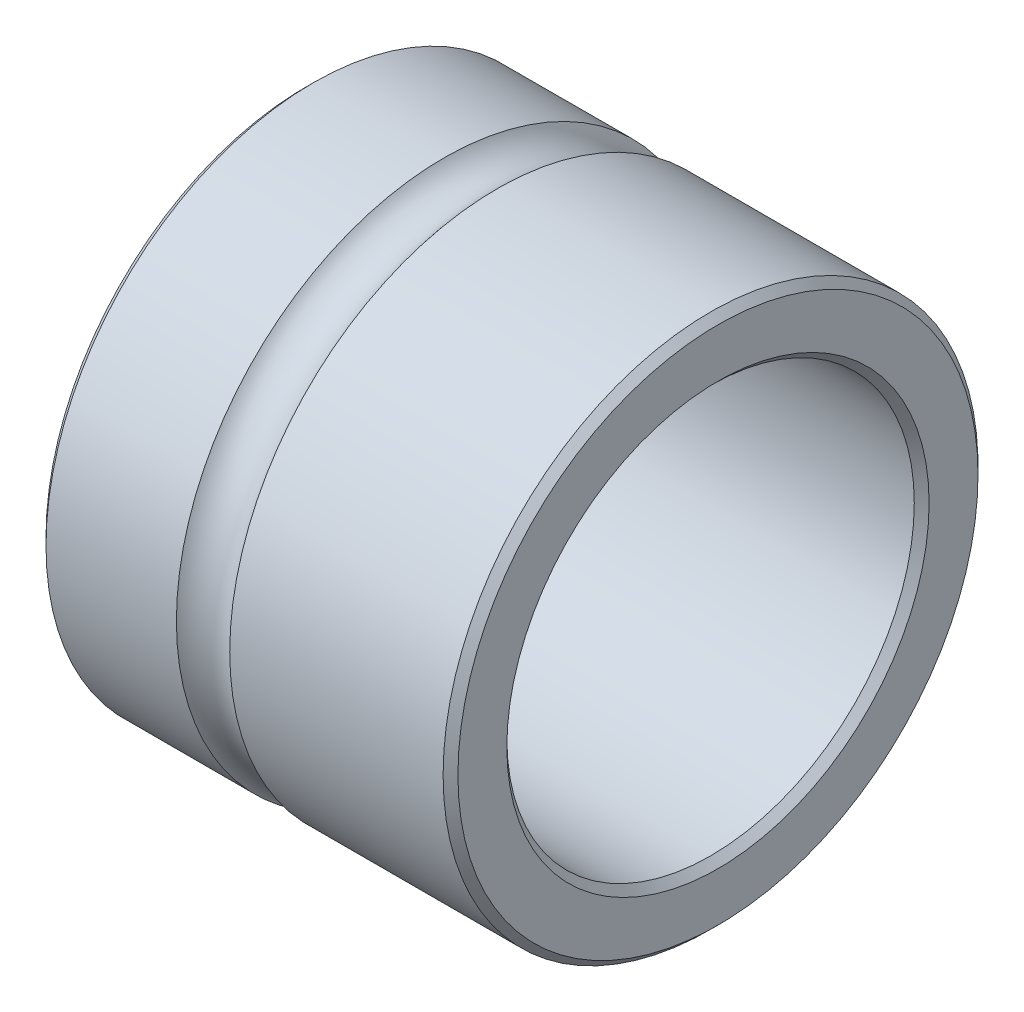
from build123d import *

# Parameters (mm, degrees)
CHAMFER_1_SIZE = 1


with BuildPart() as part:
    # 草图1 → 旋转1 (revolve)
    with BuildSketch(Plane.XY):
        with BuildLine():
            Line((-22.2, 27.5), (33.4, 27.5))
            Line((33.4, 27.5), (33.4, 36.1))
            Line((33.4, 36.1), (3.6, 36.1))
            ThreePointArc((3.6, 36.1), (0, 34.3), (-3.6, 36.1))
            Line((-3.6, 36.1), (-22.2, 36.1))
            Line((-22.2, 36.1), (-22.2, 27.5))
        make_face()
    revolve(axis=Axis((-55.01659168, 0, 0), (1, 0, 0)))

    # 倒角1
    chamfer_1_edges = [part.edges().sort_by_distance(p)[0] for p in [
        (-22.2, -36.1, 0),
        (-22.2, -27.5, 0),
        (33.4, -27.5, 0),
        (33.4, -36.1, 0),
    ]]
    chamfer(chamfer_1_edges, length=CHAMFER_1_SIZE)


solid = part.part
